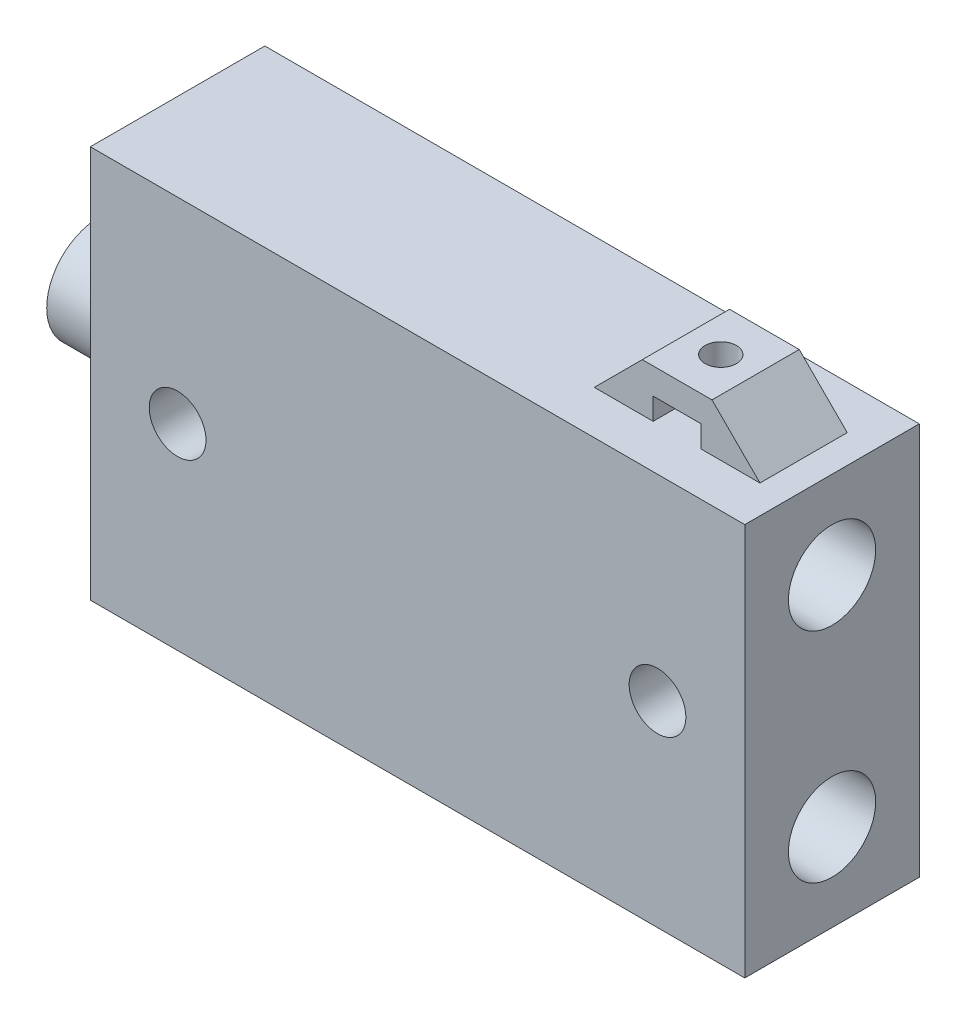
from build123d import *

# Parameters (mm, degrees)
SKETCH1_W               = 20
SKETCH1_H               = 45
SKETCH1_R               = 5
BOSS_EXTRUDE1_DEPTH     = 75
SKETCH2_R               = 3.25
CUT_EXTRUDE1_DEPTH      = 90.721792225
SKETCH5_R               = 6
SKETCH5_R_2             = 2.75
BOSS_EXTRUDE3_DEPTH     = 9
CUT_EXTRUDE2_REACH      = 91.722
SKETCH6_R               = 2.75
BOSS_EXTRUDE4_DEPTH     = 5
CUT_EXTRUDE3_REACH      = 94.603
CUT_EXTRUDE3_END_RADIUS = 6
SKETCH9_R               = 1.8


with BuildPart() as part:
    # Sketch1 → Boss-Extrude1 (new body)
    with BuildSketch(Plane(origin=(0, 0, 0), x_dir=(0, 0, -1), z_dir=(1, 0, 0))):
        with Locations((10, 22.5)):
            Rectangle(SKETCH1_W, SKETCH1_H)
        with Locations((10, 35)):
            Circle(SKETCH1_R, mode=Mode.SUBTRACT)
        with Locations((10, 10)):
            Circle(SKETCH1_R, mode=Mode.SUBTRACT)
    extrude(amount=BOSS_EXTRUDE1_DEPTH)

    # Sketch2 → Cut-Extrude1 (cut, through all)
    with BuildSketch(Plane.XY):
        with Locations((10, 22.5)):
            Circle(SKETCH2_R)
        with Locations((65, 22.5)):
            Circle(SKETCH2_R)
    extrude(amount=-CUT_EXTRUDE1_DEPTH, mode=Mode.SUBTRACT)

    # Sketch4 → Cut-Revolve1 (revolve, cut)
    with BuildSketch(Plane.XY.offset(-10), mode=Mode.PRIVATE) as cut_revolve1_sk:
        Polygon((12, 40), (13.732050808, 41), (61.267949192, 41), (63, 40), align=None)
    cut_revolve1 = revolve(cut_revolve1_sk.sketch.rotate(Axis((75, 35, -10), (-1, 0, 0)), 90), axis=Axis((75, 35, -10), (-1, 0, 0)), mode=Mode.SUBTRACT)

    # Mirror1: Cut-Revolve1 across plane
    add(cut_revolve1.mirror(Plane.ZX.offset(22.5)), mode=Mode.SUBTRACT)

    # Sketch5 → Boss-Extrude3 (add)
    with BuildSketch(Plane.ZY):
        with Locations((-10, 22.5)):
            Circle(SKETCH5_R)
        with Locations((-10, 22.5)):
            Circle(SKETCH5_R_2, mode=Mode.SUBTRACT)
    extrude(amount=BOSS_EXTRUDE3_DEPTH)

    # Sketch6 → Cut-Extrude2 (cut, up to next)
    with BuildSketch(Plane.ZY, mode=Mode.PRIVATE) as cut_extrude2_sk1:
        with Locations((-10, 22.5)):
            Circle(SKETCH6_R)
    cut_extrude2_tool1 = extrude(cut_extrude2_sk1.sketch, amount=-CUT_EXTRUDE2_REACH, mode=Mode.PRIVATE) & part.part
    add(cut_extrude2_tool1.solids().sort_by_distance((0, 22.5, -10))[0], mode=Mode.SUBTRACT)

    # Sketch8 → Boss-Extrude4 (add, symmetric)
    with BuildSketch(Plane.XY.offset(-10)):
        Polygon((52.757359313, 45), (58.257359313, 50.5), (66.242640687, 50.5), (71.742640687, 45), (65, 45), (65, 47.5), (59.5, 47.5), (59.5, 45), align=None)
    extrude(amount=BOSS_EXTRUDE4_DEPTH, both=True)

    # Cut-Extrude3: up to this cylinder (the profile starts outside it)
    cut_extrude3_end = Plane(origin=(62.25, 35, -10), z_dir=(1, 0, 0)) * Cylinder(CUT_EXTRUDE3_END_RADIUS, 202.206, mode=Mode.PRIVATE)
    # Sketch9 → Cut-Extrude3 (cut, up to the surface)
    with BuildSketch(Plane(origin=(0, 50.5, 0), x_dir=(1, 0, 0), z_dir=(0, 1, 0)), mode=Mode.PRIVATE) as cut_extrude3_sk1:
        with Locations(Location((62.25, 10, 0), (0, 0, 270))):
            Circle(SKETCH9_R)
    cut_extrude3_tool1 = extrude(cut_extrude3_sk1.sketch, amount=-CUT_EXTRUDE3_REACH, mode=Mode.PRIVATE) - cut_extrude3_end
    add(cut_extrude3_tool1.solids().sort_by_distance((62.25, 50.5, -10))[0], mode=Mode.SUBTRACT)


solid = part.part
